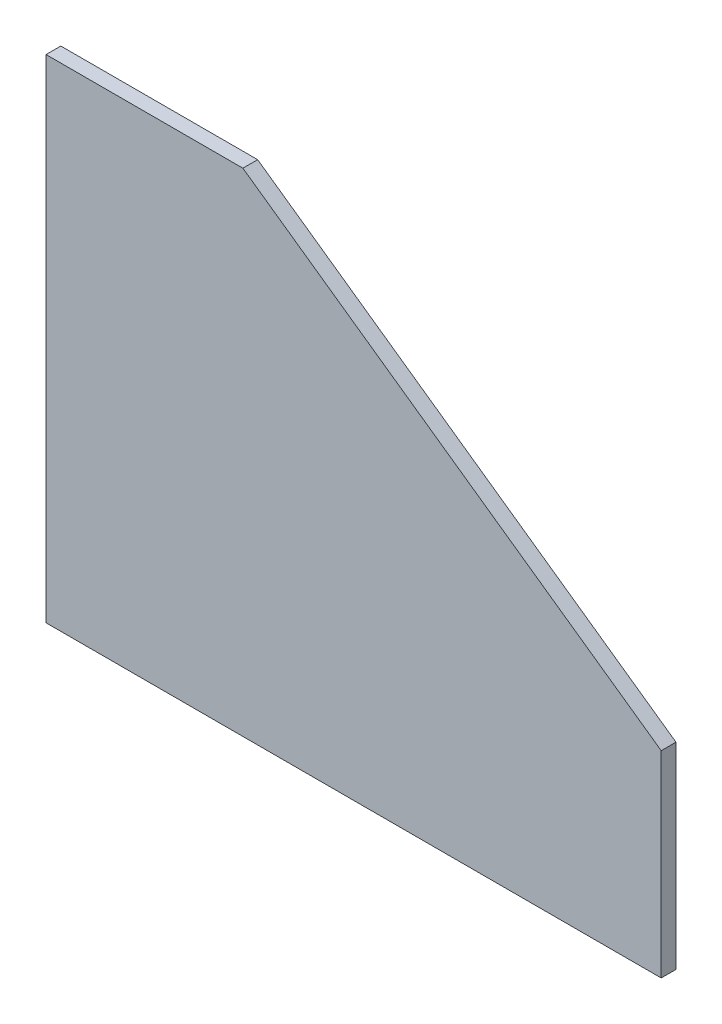
from build123d import *

# Parameters (mm, degrees)
SALIENTE_EXTRUIR1_DEPTH = 6


with BuildPart() as part:
    # Croquis1 → Saliente-Extruir1 (new body)
    with BuildSketch(Plane.XY):
        Polygon((0, 0), (250, 0), (250, 80), (80, 200), (0, 200), align=None)
    extrude(amount=SALIENTE_EXTRUIR1_DEPTH)


solid = part.part
